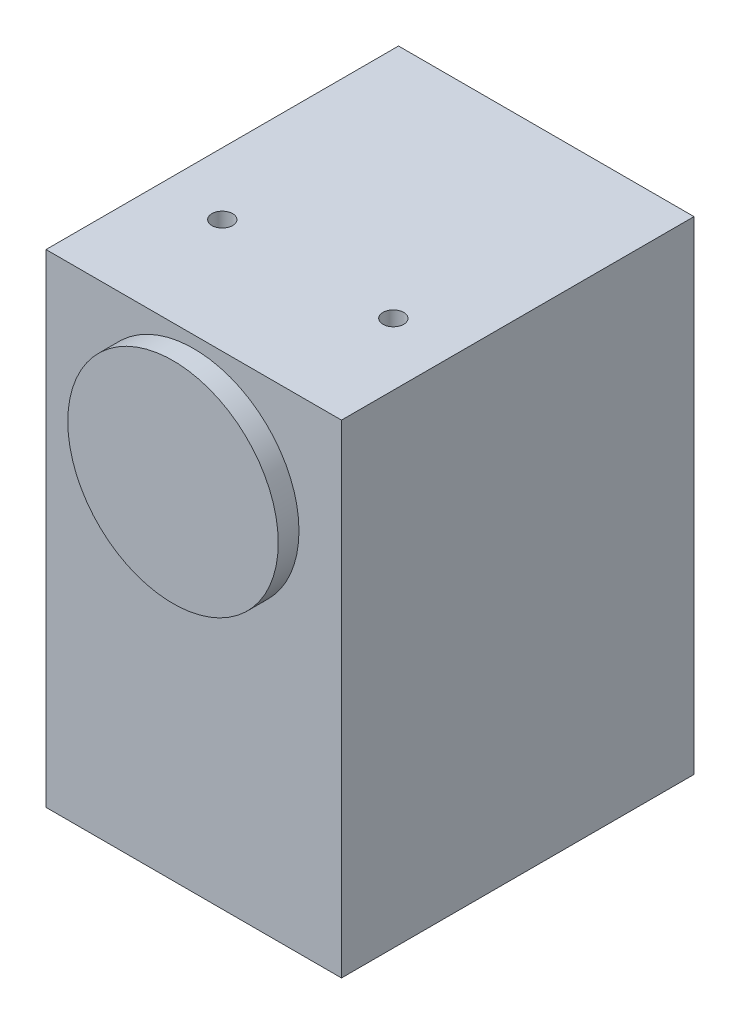
from build123d import *

# Parameters (mm, degrees)
ESQUISSE1_W             = 28.5
ESQUISSE1_H             = 46.6
BOSS_EXTRU_1_DEPTH      = 34
ESQUISSE2_R             = 10.15
BOSS_EXTRU_2_DEPTH      = 2
ESQUISSE3_R             = 1
ENL_V_MAT_EXTRU_1_DEPTH = 2


with BuildPart() as part:
    # Esquisse1 → Boss.-Extru.1 (new body)
    with BuildSketch(Plane.XY):
        Rectangle(ESQUISSE1_W, ESQUISSE1_H)
    extrude(amount=BOSS_EXTRU_1_DEPTH)

    # Esquisse2 → Boss.-Extru.2 (add)
    with BuildSketch(Plane.XY.offset(34)):
        with Locations((0, 12)):
            Circle(ESQUISSE2_R)
    extrude(amount=BOSS_EXTRU_2_DEPTH)

    # Esquisse3 → Enlèv. mat.-Extru.1 (cut)
    with BuildSketch(Plane(origin=(0, 23.3, 0), x_dir=(1, 0, 0), z_dir=(0, 1, 0))):
        with Locations(Location((-8.25, -23, 0), (0, 0, 270))):
            Circle(ESQUISSE3_R)
        with Locations(Location((8.25, -23, 0), (0, 0, 270))):
            Circle(ESQUISSE3_R)
    extrude(amount=-ENL_V_MAT_EXTRU_1_DEPTH, mode=Mode.SUBTRACT)


solid = part.part
